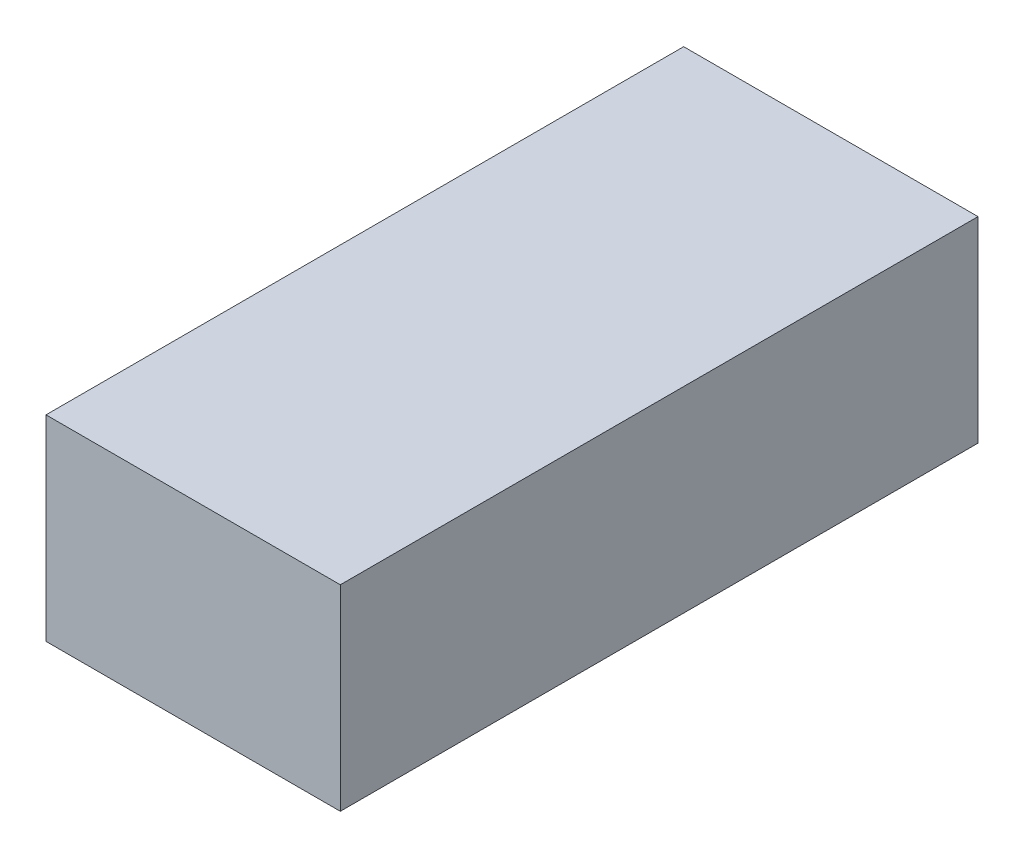
from build123d import *

# Parameters (mm, degrees)
SKETCH_1_W      = 6
SKETCH_1_H      = 4
EXTRUDE_1_DEPTH = 13


with BuildPart() as part:
    # Эскиз1 → Бобышка-Вытянуть1 (new body)
    with BuildSketch(Plane.XY):
        Rectangle(SKETCH_1_W, SKETCH_1_H)
    extrude(amount=EXTRUDE_1_DEPTH)


solid = part.part
